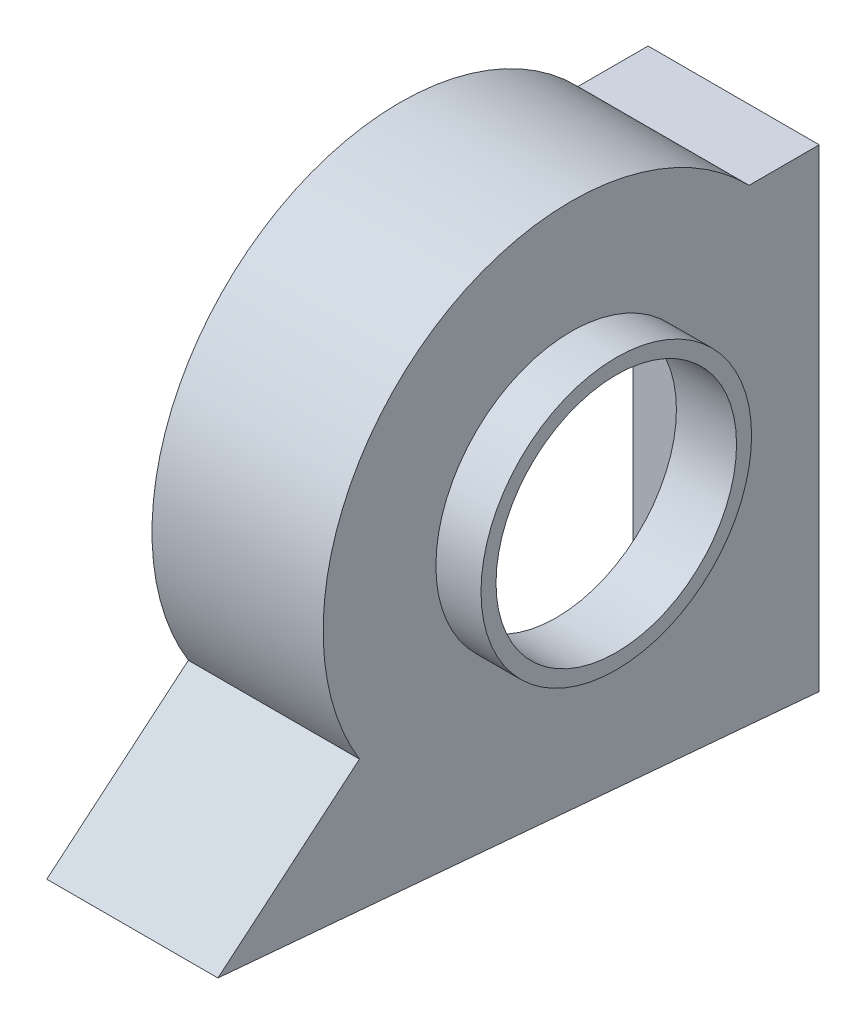
from build123d import *

# Parameters (mm, degrees)
SKETCH1_W           = 11.385
SKETCH1_H           = 40
BOSS_EXTRUDE1_DEPTH = 35
CUT_EXTRUDE3_DEPTH  = 42.888163304
SKETCH2_R           = 9
BOSS_EXTRUDE2_DEPTH = 3
SKETCH7_W           = 11.385
SKETCH7_H           = 40
BOSS_EXTRUDE3_DEPTH = 6
CUT_EXTRUDE4_DEPTH  = 41.232054695
SHELL1_T            = -1
SKETCH4_R           = 8
CUT_EXTRUDE2_DEPTH  = 6
SKETCH9_R           = 3
CUT_EXTRUDE5_DEPTH  = 7


with BuildPart() as part:
    # Sketch1 → Boss-Extrude1 (new body)
    with BuildSketch(Plane(origin=(0, 0, 0), x_dir=(1, 0, 0), z_dir=(0, 1, 0))):
        Rectangle(SKETCH1_W, SKETCH1_H)
    extrude(amount=BOSS_EXTRUDE1_DEPTH)

    # Sketch6 → Cut-Extrude3 (cut, through all)
    with BuildSketch(Plane(origin=(5.6925, 0, 0), x_dir=(0, 0, -1), z_dir=(1, 0, 0))):
        with BuildLine():
            Line((-20, 0), (-10.582767317, 7.901996471))
            ThreePointArc((-10.582767317, 7.901996471), (-6.611812166, 29.538452927), (15.332159566, 28))
            Line((15.332159566, 28), (20, 28))
            Line((20, 28), (20, 35))
            Line((20, 35), (-20, 35))
            Line((-20, 35), (-20, 0))
        make_face()
    extrude(amount=-CUT_EXTRUDE3_DEPTH, mode=Mode.SUBTRACT)

    # Sketch2 → Boss-Extrude2 (add)
    with BuildSketch(Plane(origin=(5.6925, 0, 0), x_dir=(0, 0, -1), z_dir=(1, 0, 0))):
        with Locations(Location((3.5, 16.5, 0), (0, 0, 180))):
            Circle(SKETCH2_R)
    extrude(amount=BOSS_EXTRUDE2_DEPTH)

    # Sketch7 → Boss-Extrude3 (add)
    with BuildSketch(Plane.XZ):
        Rectangle(SKETCH7_W, SKETCH7_H)
    extrude(amount=BOSS_EXTRUDE3_DEPTH)

    # Sketch8 → Cut-Extrude4 (cut, through all)
    with BuildSketch(Plane(origin=(5.6925, 0, 0), x_dir=(0, 0, -1), z_dir=(1, 0, 0))):
        Polygon((-20, 0), (20, -3.499546541), (20, -6), (-20, -6), align=None)
    extrude(amount=-CUT_EXTRUDE4_DEPTH, mode=Mode.SUBTRACT)

    # Shell1
    shell1_openings = [part.faces().sort_by_distance(p)[0] for p in [
        (-5.6925, 13.86447458, -3.717094952),
    ]]
    offset(amount=SHELL1_T, openings=shell1_openings, kind=Kind.INTERSECTION)

    # Sketch4 → Cut-Extrude2 (cut)
    with BuildSketch(Plane.ZY.offset(-7.6925)):
        with Locations((-3.5, 16.5)):
            Circle(SKETCH4_R)
    extrude(amount=-CUT_EXTRUDE2_DEPTH, mode=Mode.SUBTRACT)

    # Sketch9 → Cut-Extrude5 (cut)
    with BuildSketch(Plane(origin=(0, 0, -20), x_dir=(-1, 0, 0), z_dir=(0, 0, -1))):
        with Locations((5.6925, 16.5)):
            Circle(SKETCH9_R)
    extrude(amount=-CUT_EXTRUDE5_DEPTH, mode=Mode.SUBTRACT)


solid = part.part
